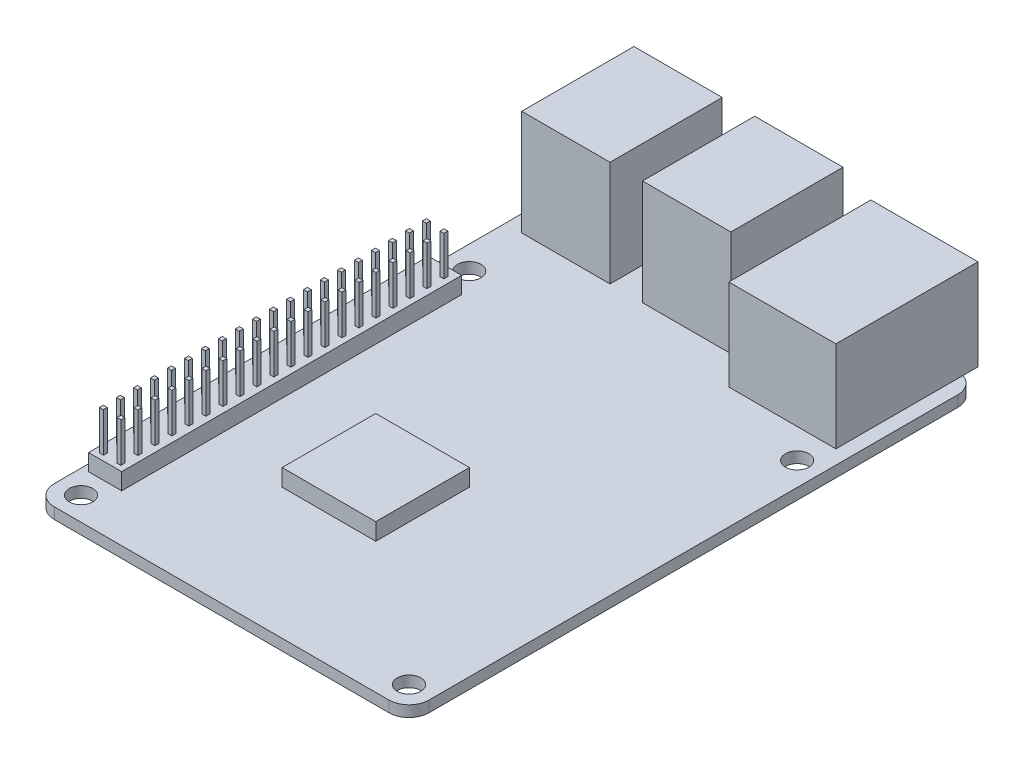
from build123d import *

# Parameters (mm, degrees)
SKETCH1_R           = 1.75
BOSS_EXTRUDE1_DEPTH = 1.651
SKETCH2_W           = 13.1953
SKETCH2_H           = 16.764
BOSS_EXTRUDE2_DEPTH = 15.748
SKETCH4_W           = 16.002
SKETCH4_H           = 21.23186
BOSS_EXTRUDE3_DEPTH = 13.589
SKETCH3_W           = 10.6553
SKETCH3_H           = 5.969
SKETCH3_W_2         = 13.462
SKETCH3_H_2         = 11.049
CUT_EXTRUDE1_DEPTH  = 15.748
SKETCH5_W           = 4.953
SKETCH5_H           = 50.8
BOSS_EXTRUDE4_DEPTH = 2.4892
SKETCH6_W           = 0.5969
SKETCH6_H           = 0.5969
BOSS_EXTRUDE5_DEPTH = 5.8928
SKETCH7_W           = 13.9954
SKETCH7_H           = 13.9954
BOSS_EXTRUDE6_DEPTH = 2.54


with BuildPart() as part:
    # Sketch1 → Boss-Extrude1 (new body)
    with BuildSketch(Plane(origin=(0, 0, 0), x_dir=(1, 0, 0), z_dir=(0, 1, 0))):
        with BuildLine():
            Line((-25, -42.5), (25, -42.5))
            ThreePointArc((25, -42.5), (27.121320344, -41.621320344), (28, -39.5))
            Line((28, -39.5), (28, 39.5))
            ThreePointArc((28, 39.5), (27.121320344, 41.621320344), (25, 42.5))
            Line((25, 42.5), (-25, 42.5))
            ThreePointArc((-25, 42.5), (-27.121320344, 41.621320344), (-28, 39.5))
            Line((-28, 39.5), (-28, -39.5))
            ThreePointArc((-28, -39.5), (-27.121320344, -41.621320344), (-25, -42.5))
        make_face()
        with Locations(Location((24.5, 19, 0), (0, 0, 90))):
            Circle(SKETCH1_R, mode=Mode.SUBTRACT)
        with Locations(Location((-24.5, 19, 0), (0, 0, 90))):
            Circle(SKETCH1_R, mode=Mode.SUBTRACT)
        with Locations(Location((-24.5, -39, 0), (0, 0, 90))):
            Circle(SKETCH1_R, mode=Mode.SUBTRACT)
        with Locations(Location((24.5, -39, 0), (0, 0, 90))):
            Circle(SKETCH1_R, mode=Mode.SUBTRACT)
    extrude(amount=BOSS_EXTRUDE1_DEPTH)

    # Sketch2 → Boss-Extrude2 (add)
    with BuildSketch(Plane(origin=(0, 1.651, 0), x_dir=(1, 0, 0), z_dir=(0, 1, 0))):
        with Locations((-18.91315, 36.2389)):
            Rectangle(SKETCH2_W, SKETCH2_H)
        with Locations((-0.86645, 36.2389)):
            Rectangle(SKETCH2_W, SKETCH2_H)
    extrude(amount=BOSS_EXTRUDE2_DEPTH)

    # Sketch4 → Boss-Extrude3 (add)
    with BuildSketch(Plane(origin=(0, 1.651, 0), x_dir=(1, 0, 0), z_dir=(0, 1, 0))):
        with Locations((17.8978, 34.00497)):
            Rectangle(SKETCH4_W, SKETCH4_H)
    extrude(amount=BOSS_EXTRUDE3_DEPTH)

    # Sketch3 → Cut-Extrude1 (cut)
    with BuildSketch(Plane(origin=(0, 0, -44.6209), x_dir=(-1, 0, 0), z_dir=(0, 0, -1))):
        with Locations((18.91315, 5.9055)):
            Rectangle(SKETCH3_W, SKETCH3_H)
        with Locations((18.91315, 13.1445)):
            Rectangle(SKETCH3_W, SKETCH3_H)
        with Locations((0.86645, 5.9055)):
            Rectangle(SKETCH3_W, SKETCH3_H)
        with Locations((0.86645, 13.1445)):
            Rectangle(SKETCH3_W, SKETCH3_H)
        with Locations((-17.8978, 8.4455)):
            Rectangle(SKETCH3_W_2, SKETCH3_H_2)
    extrude(amount=-CUT_EXTRUDE1_DEPTH, mode=Mode.SUBTRACT)

    # Sketch5 → Boss-Extrude4 (add)
    with BuildSketch(Plane(origin=(0, 1.651, 0), x_dir=(1, 0, 0), z_dir=(0, 1, 0))):
        with Locations((-24.5, -10)):
            Rectangle(SKETCH5_W, SKETCH5_H)
    extrude(amount=BOSS_EXTRUDE4_DEPTH)

    # Sketch6 → Boss-Extrude5 (add)
    with BuildSketch(Plane(origin=(0, 4.1402, 0), x_dir=(1, 0, 0), z_dir=(0, 1, 0))):
        with Locations((-25.8081, 13.90775)):
            Rectangle(SKETCH6_W, SKETCH6_H)
        with Locations((-23.1919, 13.90775)):
            Rectangle(SKETCH6_W, SKETCH6_H)
        with Locations((-25.8081, 11.36775)):
            Rectangle(SKETCH6_W, SKETCH6_H)
        with Locations((-23.1919, 11.36775)):
            Rectangle(SKETCH6_W, SKETCH6_H)
        with Locations((-25.8081, 8.82775)):
            Rectangle(SKETCH6_W, SKETCH6_H)
        with Locations((-23.1919, 8.82775)):
            Rectangle(SKETCH6_W, SKETCH6_H)
        with Locations((-25.8081, 6.28775)):
            Rectangle(SKETCH6_W, SKETCH6_H)
        with Locations((-23.1919, 6.28775)):
            Rectangle(SKETCH6_W, SKETCH6_H)
        with Locations((-25.8081, 3.74775)):
            Rectangle(SKETCH6_W, SKETCH6_H)
        with Locations((-23.1919, 3.74775)):
            Rectangle(SKETCH6_W, SKETCH6_H)
        with Locations((-25.8081, 1.20775)):
            Rectangle(SKETCH6_W, SKETCH6_H)
        with Locations((-23.1919, 1.20775)):
            Rectangle(SKETCH6_W, SKETCH6_H)
        with Locations((-25.8081, -1.33225)):
            Rectangle(SKETCH6_W, SKETCH6_H)
        with Locations((-23.1919, -1.33225)):
            Rectangle(SKETCH6_W, SKETCH6_H)
        with Locations((-25.8081, -3.87225)):
            Rectangle(SKETCH6_W, SKETCH6_H)
        with Locations((-23.1919, -3.87225)):
            Rectangle(SKETCH6_W, SKETCH6_H)
        with Locations((-25.8081, -6.41225)):
            Rectangle(SKETCH6_W, SKETCH6_H)
        with Locations((-23.1919, -6.41225)):
            Rectangle(SKETCH6_W, SKETCH6_H)
        with Locations((-25.8081, -8.95225)):
            Rectangle(SKETCH6_W, SKETCH6_H)
        with Locations((-23.1919, -8.95225)):
            Rectangle(SKETCH6_W, SKETCH6_H)
        with Locations((-25.8081, -11.49225)):
            Rectangle(SKETCH6_W, SKETCH6_H)
        with Locations((-23.1919, -11.49225)):
            Rectangle(SKETCH6_W, SKETCH6_H)
        with Locations((-25.8081, -14.03225)):
            Rectangle(SKETCH6_W, SKETCH6_H)
        with Locations((-23.1919, -14.03225)):
            Rectangle(SKETCH6_W, SKETCH6_H)
        with Locations((-25.8081, -16.57225)):
            Rectangle(SKETCH6_W, SKETCH6_H)
        with Locations((-23.1919, -16.57225)):
            Rectangle(SKETCH6_W, SKETCH6_H)
        with Locations((-25.8081, -19.11225)):
            Rectangle(SKETCH6_W, SKETCH6_H)
        with Locations((-23.1919, -19.11225)):
            Rectangle(SKETCH6_W, SKETCH6_H)
        with Locations((-25.8081, -21.65225)):
            Rectangle(SKETCH6_W, SKETCH6_H)
        with Locations((-23.1919, -21.65225)):
            Rectangle(SKETCH6_W, SKETCH6_H)
        with Locations((-25.8081, -24.19225)):
            Rectangle(SKETCH6_W, SKETCH6_H)
        with Locations((-23.1919, -24.19225)):
            Rectangle(SKETCH6_W, SKETCH6_H)
        with Locations((-25.8081, -26.73225)):
            Rectangle(SKETCH6_W, SKETCH6_H)
        with Locations((-23.1919, -26.73225)):
            Rectangle(SKETCH6_W, SKETCH6_H)
        with Locations((-25.8081, -29.27225)):
            Rectangle(SKETCH6_W, SKETCH6_H)
        with Locations((-23.1919, -29.27225)):
            Rectangle(SKETCH6_W, SKETCH6_H)
        with Locations((-25.8081, -31.81225)):
            Rectangle(SKETCH6_W, SKETCH6_H)
        with Locations((-23.1919, -31.81225)):
            Rectangle(SKETCH6_W, SKETCH6_H)
        with Locations((-25.8081, -34.35225)):
            Rectangle(SKETCH6_W, SKETCH6_H)
        with Locations((-23.1919, -34.35225)):
            Rectangle(SKETCH6_W, SKETCH6_H)
    extrude(amount=BOSS_EXTRUDE5_DEPTH)

    # Sketch7 → Boss-Extrude6 (add)
    with BuildSketch(Plane(origin=(0, 1.651, 0), x_dir=(1, 0, 0), z_dir=(0, 1, 0))):
        with Locations((-3.5196, -15.9443)):
            Rectangle(SKETCH7_W, SKETCH7_H)
    extrude(amount=BOSS_EXTRUDE6_DEPTH)


solid = part.part
